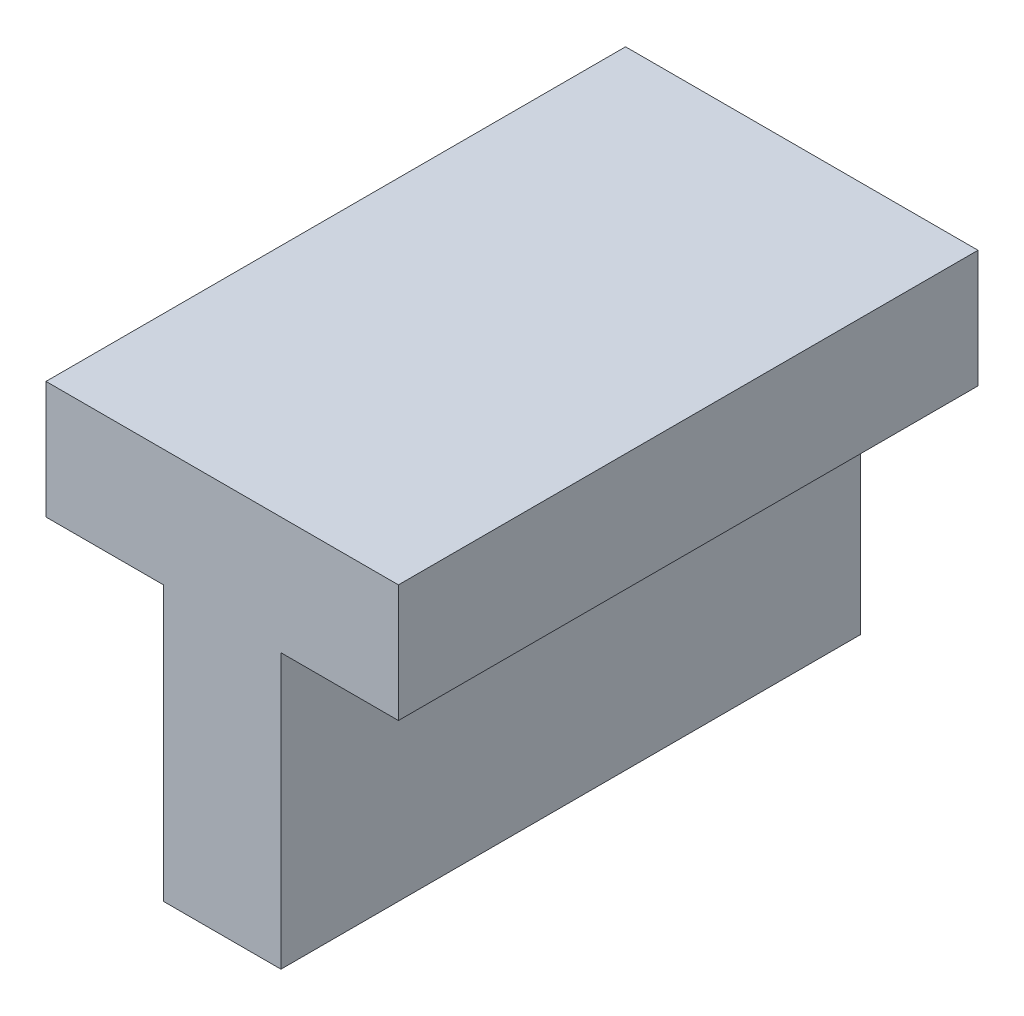
from build123d import *

# Parameters (mm, degrees)
BOSS_EXTRUDE1_DEPTH = 14.8


with BuildPart() as part:
    # Sketch1 → Boss-Extrude1 (new body)
    with BuildSketch(Plane.XY):
        Polygon((-1.5, -10), (1.5, -10), (1.5, -3), (4.5, -3), (4.5, 0), (-4.5, 0), (-4.5, -3), (-1.5, -3), align=None)
    extrude(amount=BOSS_EXTRUDE1_DEPTH)


solid = part.part
